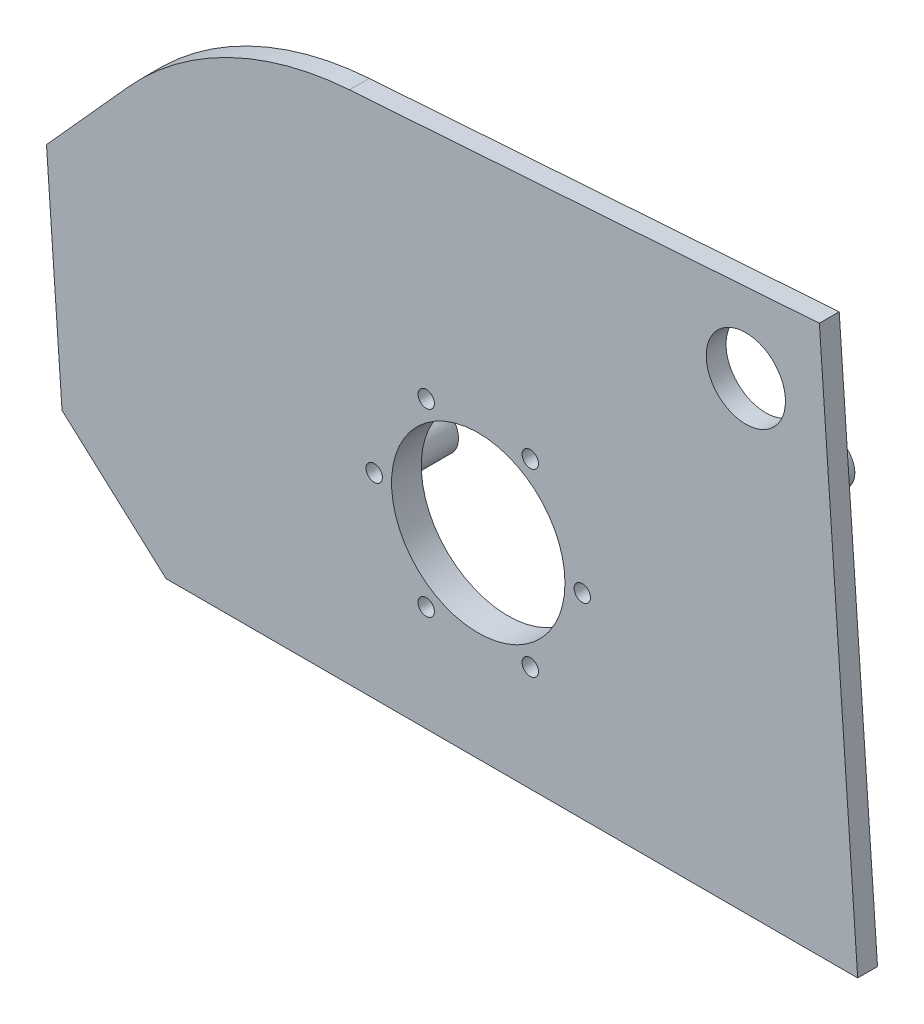
from build123d import *

# Parameters (mm, degrees)
SKETCH2_R           = 8
SKETCH2_R_2         = 17.5
BOSS_EXTRUDE2_DEPTH = 4
SKETCH2_3_R         = 17.5
BOSS_EXTRUDE3_DEPTH = 6
SKETCH2_6_R         = 1.65
CUT_EXTRUDE1_DEPTH  = 113.610704204
BOSS_EXTRUDE4_DEPTH = 31.5
CUT_EXTRUDE2_START  = -31.5
SKETCH2_8_R         = 2.2
CUT_EXTRUDE2_DEPTH  = 7


with BuildPart() as part:
    # Sketch2 → Boss-Extrude2 (new body)
    with BuildSketch(Plane.XY):
        with BuildLine():
            Line((-87.139041318, 24.298867192), (-84, -20.59151507))
            Line((-84, -20.59151507), (-63, -39.5))
            Line((-63, -39.5), (76.577227286, -39.5))
            Line((76.577227286, -39.5), (68.844921224, 71.077128384))
            Line((68.844921224, 71.077128384), (-26, 64.444925414))
            ThreePointArc((-26, 64.444925414), (-50.392441883, 57.90899031), (-70.560315786, 42.711407248))
            Line((-70.560315786, 42.711407248), (-87.139041318, 24.298867192))
        make_face()
        with Locations((54, 54)):
            Circle(SKETCH2_R, mode=Mode.SUBTRACT)
        Circle(SKETCH2_R_2, mode=Mode.SUBTRACT)
    extrude(amount=-BOSS_EXTRUDE2_DEPTH)

    # Sketch2<3> → Boss-Extrude3 (add)
    with BuildSketch(Plane.XY):
        with BuildLine():
            ThreePointArc((-14.486986043, 17.864132652), (-19.918584287, 11.5), (-22.714285714, 3.614031612))
            ThreePointArc((-22.714285714, 3.614031612), (-25, 0), (-22.714285714, -3.614031612))
            ThreePointArc((-22.714285714, -3.614031612), (-19.918584287, -11.5), (-14.486986043, -17.864132652))
            ThreePointArc((-14.486986043, -17.864132652), (-12.5, -21.650635095), (-8.227299671, -21.478164263))
            ThreePointArc((-8.227299671, -21.478164263), (0, -23), (8.227299671, -21.478164263))
            ThreePointArc((8.227299671, -21.478164263), (12.5, -21.650635095), (14.486986043, -17.864132652))
            ThreePointArc((14.486986043, -17.864132652), (19.918584287, -11.5), (22.714285714, -3.614031612))
            ThreePointArc((22.714285714, -3.614031612), (25, 0), (22.714285714, 3.614031612))
            ThreePointArc((22.714285714, 3.614031612), (19.918584287, 11.5), (14.486986043, 17.864132652))
            ThreePointArc((14.486986043, 17.864132652), (12.5, 21.650635095), (8.227299671, 21.478164263))
            ThreePointArc((8.227299671, 21.478164263), (0, 23), (-8.227299671, 21.478164263))
            ThreePointArc((-8.227299671, 21.478164263), (-12.5, 21.650635095), (-14.486986043, 17.864132652))
        make_face()
        Circle(SKETCH2_3_R, mode=Mode.SUBTRACT)
    extrude(amount=-BOSS_EXTRUDE3_DEPTH)

    # Sketch2<6> → Cut-Extrude1 (cut, through all)
    with BuildSketch(Plane.XY):
        with Locations((-10.5, 18.186533479)):
            Circle(SKETCH2_6_R)
        with Locations((10.5, 18.186533479)):
            Circle(SKETCH2_6_R)
        with Locations((21, 0)):
            Circle(SKETCH2_6_R)
        with Locations((10.5, -18.186533479)):
            Circle(SKETCH2_6_R)
        with Locations((-10.5, -18.186533479)):
            Circle(SKETCH2_6_R)
        with Locations((-21, 0)):
            Circle(SKETCH2_6_R)
    extrude(amount=-CUT_EXTRUDE1_DEPTH, mode=Mode.SUBTRACT)

    # Sketch2<7> → Boss-Extrude4 (add)
    with BuildSketch(Plane.XY):
        with BuildLine():
            Line((-42.5, 13.258342613), (-42.5, -13.258342613))
            ThreePointArc((-42.5, -13.258342613), (-40, -21.5), (-37.5, -13.258342613))
            Line((-37.5, -13.258342613), (-37.5, 13.258342613))
            ThreePointArc((-37.5, 13.258342613), (-40, 21.5), (-42.5, 13.258342613))
        make_face()
        with BuildLine():
            Line((42.5, 13.258342613), (42.5, -13.258342613))
            ThreePointArc((42.5, -13.258342613), (40, -21.5), (37.5, -13.258342613))
            Line((37.5, -13.258342613), (37.5, 13.258342613))
            ThreePointArc((37.5, 13.258342613), (40, 21.5), (42.5, 13.258342613))
        make_face()
    extrude(amount=-BOSS_EXTRUDE4_DEPTH)

    # Sketch2<8> → Cut-Extrude2 (cut)
    with BuildSketch(Plane.XY.offset(CUT_EXTRUDE2_START)):
        with Locations(Location((-40, 17, 0), (0, 0, 180))):
            Circle(SKETCH2_8_R)
        with Locations(Location((-40, -17, 0), (0, 0, 180))):
            Circle(SKETCH2_8_R)
        with Locations(Location((40, 17, 0), (0, 0, 180))):
            Circle(SKETCH2_8_R)
        with Locations(Location((40, -17, 0), (0, 0, 180))):
            Circle(SKETCH2_8_R)
    extrude(amount=CUT_EXTRUDE2_DEPTH, mode=Mode.SUBTRACT)


solid = part.part
